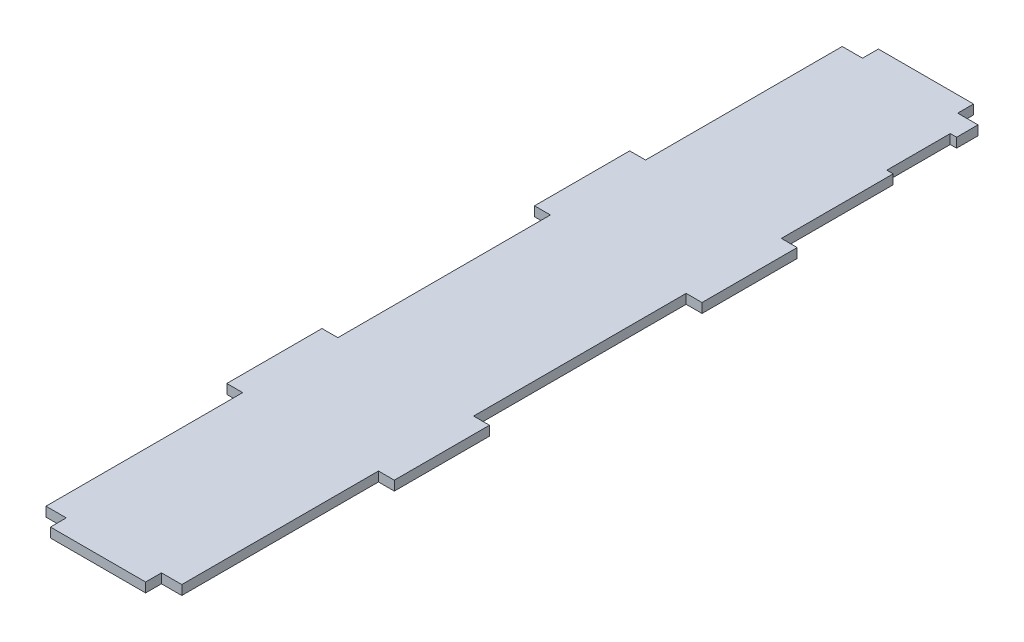
from build123d import *

# Parameters (mm, degrees)
SKETCH1_W           = 52.8
SKETCH1_H           = 261
BOSS_EXTRUDE1_DEPTH = 3
SKETCH2_W           = 5
SKETCH2_H           = 67
CUT_EXTRUDE1_DEPTH  = 134.177362941
SKETCH3_W           = 2
SKETCH3_H           = 20
CUT_EXTRUDE2_DEPTH  = 134.177362941


with BuildPart() as part:
    # Sketch1 → Boss-Extrude1 (new body)
    with BuildSketch(Plane(origin=(0, 0, 0), x_dir=(1, 0, 0), z_dir=(0, 1, 0))):
        Rectangle(SKETCH1_W, SKETCH1_H)
    extrude(amount=BOSS_EXTRUDE1_DEPTH)

    # Sketch2 → Cut-Extrude1 (cut, through all)
    with BuildSketch(Plane(origin=(0, 3, 0), x_dir=(1, 0, 0), z_dir=(0, 1, 0))):
        Polygon((-26.4, -130.5), (-15, -130.5), (-15, -125.5), (-21.4, -125.5), (-21.4, -63.5), (-26.4, -63.5), align=None)
        with Locations((-23.9, 0)):
            Rectangle(SKETCH2_W, SKETCH2_H)
        Polygon((-26.4, 130.5), (-15, 130.5), (-15, 125.5), (-21.4, 125.5), (-21.4, 63.5), (-26.4, 63.5), align=None)
    cut_extrude1 = extrude(amount=-CUT_EXTRUDE1_DEPTH, mode=Mode.SUBTRACT)

    # Mirror1: Cut-Extrude1 across plane
    add(cut_extrude1.mirror(Plane(origin=(0, 0, 0), x_dir=(0, 0, 1), z_dir=(1, 0, 0))), mode=Mode.SUBTRACT)

    # Sketch3 → Cut-Extrude2 (cut, through all)
    with BuildSketch(Plane(origin=(0, 3, 0), x_dir=(1, 0, 0), z_dir=(0, 1, 0))):
        with Locations((20.4, 108.75)):
            Rectangle(SKETCH3_W, SKETCH3_H)
    extrude(amount=-CUT_EXTRUDE2_DEPTH, mode=Mode.SUBTRACT)


solid = part.part
